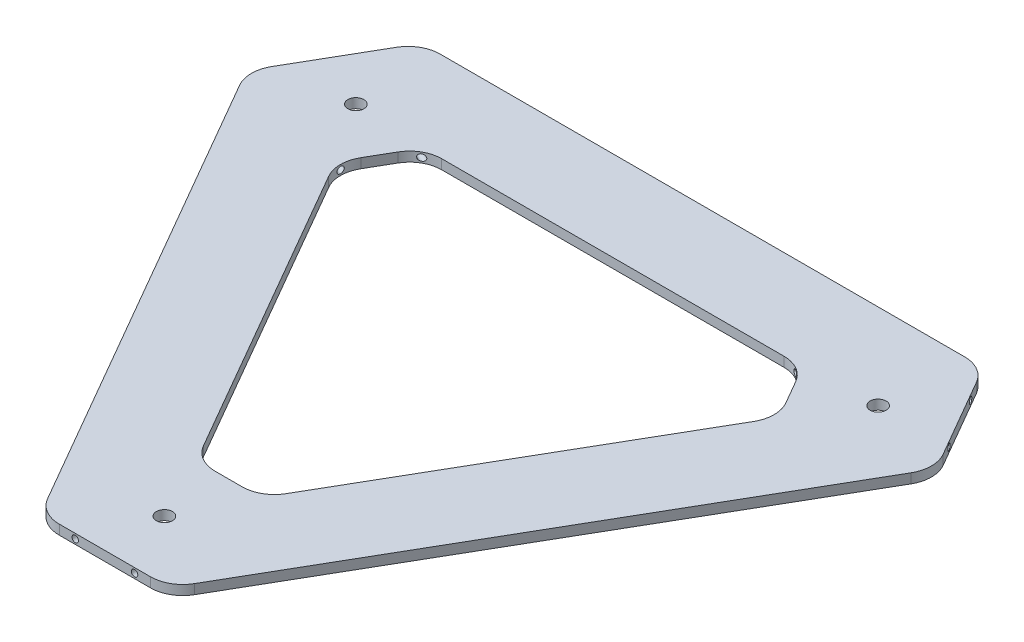
from build123d import *

# Parameters (mm, degrees)
SKETCH1_R           = 3.175
BOSS_EXTRUDE1_DEPTH = 3.81
CUT_EXTRUDE1_REACH  = 334.908
SKETCH3_R           = 1.27
CUT_EXTRUDE2_REACH  = 274.112
SKETCH5_R           = 1.27
CUT_EXTRUDE3_REACH  = 334.911
SKETCH6_R           = 1.27


with BuildPart() as part:
    # Sketch1 → Boss-Extrude1 (new body)
    with BuildSketch(Plane(origin=(0, 0, 0), x_dir=(1, 0, 0), z_dir=(0, 1, 0))):
        with BuildLine():
            Line((-132.862230357, 80.626602679), (-114.818360917, 111.876376892))
            ThreePointArc((-114.818360917, 111.876376892), (-110.170255519, 116.524341207), (-103.82099168, 118.225900714))
            Line((-103.82099168, 118.225900714), (103.762977343, 118.240259528))
            ThreePointArc((103.762977343, 118.240259528), (110.109496385, 116.541297953), (114.757781541, 111.898214981))
            Line((114.757781541, 111.898214981), (132.857908371, 80.600189632))
            ThreePointArc((132.857908371, 80.600189632), (134.563982049, 74.246129937), (132.86180691, 67.891024761))
            Line((132.86180691, 67.891024761), (29.0379736, -111.891469007))
            ThreePointArc((29.0379736, -111.891469007), (24.389544583, -116.539131318), (18.040149336, -118.240259558))
            Line((18.040149336, -118.240259558), (-18.094408415, -118.240259558))
            ThreePointArc((-18.094408415, -118.240259558), (-24.445497205, -116.538153501), (-29.09418809, -111.888081791))
            Line((-29.09418809, -111.888081791), (-132.863762321, 67.928304298))
            ThreePointArc((-132.863762321, 67.928304298), (-134.563982554, 74.277658701), (-132.862230357, 80.626602679))
        make_face()
        with Locations(Location((-103.330851621, 84.381028983, 0), (0, 0, 90))):
            Circle(SKETCH1_R, mode=Mode.SUBTRACT)
        with Locations(Location((-0.028433279, -94.702561062, 0), (0, 0, 90))):
            Circle(SKETCH1_R, mode=Mode.SUBTRACT)
        with Locations(Location((103.336854698, 84.397127461, 0), (0, 0, 90))):
            Circle(SKETCH1_R, mode=Mode.SUBTRACT)
        with BuildLine():
            Line((-84.013266269, 67.022348434), (-78.642736989, 76.323448067))
            ThreePointArc((-78.642736989, 76.323448067), (-73.995553024, 80.970880326), (-67.647495776, 82.672971564))
            Line((-67.647495776, 82.672971564), (67.773359352, 82.705030032))
            ThreePointArc((67.773359352, 82.705030032), (74.121084724, 81.006600385), (78.770291575, 76.36298581))
            Line((78.770291575, 76.36298581), (84.141622987, 67.075091406))
            ThreePointArc((84.141622987, 67.075091406), (85.847697169, 60.718674744), (84.143163353, 54.361844845))
            Line((84.143163353, 54.361844845), (16.352129804, -62.925309178))
            ThreePointArc((16.352129804, -62.925309178), (11.704017593, -67.570067982), (5.356663713, -69.27001804))
            Line((5.356663713, -69.27001804), (-5.379766134, -69.27001804))
            ThreePointArc((-5.379766134, -69.27001804), (-11.731679612, -67.567435699), (-16.380497701, -62.916190507))
            Line((-16.380497701, -62.916190507), (-84.015750126, 54.325699819))
            ThreePointArc((-84.015750126, 54.325699819), (-85.715018316, 60.674356799), (-84.013266269, 67.022348434))
        make_face(mode=Mode.SUBTRACT)
    extrude(amount=BOSS_EXTRUDE1_DEPTH)

    # Sketch3 → Cut-Extrude1 (cut, up to next)
    with BuildSketch(Plane(origin=(134.490180652, 0, -77.777728789), x_dir=(-0.5006264112230908, 0, -0.8656634429071663), z_dir=(0.8656634429071663, 0, -0.5006264112230908)), mode=Mode.PRIVATE) as cut_extrude1_sk1:
        with Locations((9.583713099, 1.905)):
            Circle(SKETCH3_R)
    cut_extrude1_tool1 = extrude(cut_extrude1_sk1.sketch, amount=-CUT_EXTRUDE1_REACH, mode=Mode.PRIVATE) & part.part
    # Sketch3 → Cut-Extrude1 (cut, up to next)
    with BuildSketch(Plane(origin=(134.490180652, 0, -77.777728789), x_dir=(-0.5006264112230908, 0, -0.8656634429071663), z_dir=(0.8656634429071663, 0, -0.5006264112230908)), mode=Mode.PRIVATE) as cut_extrude1_sk2:
        with Locations((33.073860572, 1.905)):
            Circle(SKETCH3_R)
    cut_extrude1_tool2 = extrude(cut_extrude1_sk2.sketch, amount=-CUT_EXTRUDE1_REACH, mode=Mode.PRIVATE) & part.part
    add(cut_extrude1_tool1.solids().sort_by_distance((129.692321, 1.905, -86.073999))[0], mode=Mode.SUBTRACT)
    add(cut_extrude1_tool2.solids().sort_by_distance((117.932533, 1.905, -106.408561))[0], mode=Mode.SUBTRACT)

    # Sketch5 → Cut-Extrude2 (cut, up to next)
    with BuildSketch(Plane.XY.offset(118.240259558), mode=Mode.PRIVATE) as cut_extrude2_sk1:
        with Locations((-11.784935705, 1.905)):
            Circle(SKETCH5_R)
    cut_extrude2_tool1 = extrude(cut_extrude2_sk1.sketch, amount=-CUT_EXTRUDE2_REACH, mode=Mode.PRIVATE) & part.part
    # Sketch5 → Cut-Extrude2 (cut, up to next)
    with BuildSketch(Plane.XY.offset(118.240259558), mode=Mode.PRIVATE) as cut_extrude2_sk2:
        with Locations((11.705218914, 1.905)):
            Circle(SKETCH5_R)
    cut_extrude2_tool2 = extrude(cut_extrude2_sk2.sketch, amount=-CUT_EXTRUDE2_REACH, mode=Mode.PRIVATE) & part.part
    add(cut_extrude2_tool1.solids().sort_by_distance((-11.784936, 1.905, 118.24026))[0], mode=Mode.SUBTRACT)
    add(cut_extrude2_tool2.solids().sort_by_distance((11.705219, 1.905, 118.24026))[0], mode=Mode.SUBTRACT)

    # Sketch6 → Cut-Extrude3 (cut, up to next)
    with BuildSketch(Plane(origin=(-134.555779523, 0, -77.693582727), x_dir=(-0.500037491916206, 0, 0.8660037567344326), z_dir=(-0.8660037567344328, 0, -0.500037491916206)), mode=Mode.PRIVATE) as cut_extrude3_sk1:
        with Locations((-33.174438242, 1.905)):
            Circle(SKETCH6_R)
    cut_extrude3_tool1 = extrude(cut_extrude3_sk1.sketch, amount=-CUT_EXTRUDE3_REACH, mode=Mode.PRIVATE) & part.part
    # Sketch6 → Cut-Extrude3 (cut, up to next)
    with BuildSketch(Plane(origin=(-134.555779523, 0, -77.693582727), x_dir=(-0.500037491916206, 0, 0.8660037567344326), z_dir=(-0.8660037567344328, 0, -0.500037491916206)), mode=Mode.PRIVATE) as cut_extrude3_sk2:
        with Locations((-9.684283586, 1.905)):
            Circle(SKETCH6_R)
    cut_extrude3_tool2 = extrude(cut_extrude3_sk2.sketch, amount=-CUT_EXTRUDE3_REACH, mode=Mode.PRIVATE) & part.part
    add(cut_extrude3_tool1.solids().sort_by_distance((-117.967317, 1.905, -106.422771))[0], mode=Mode.SUBTRACT)
    add(cut_extrude3_tool2.solids().sort_by_distance((-129.713275, 1.905, -86.080209))[0], mode=Mode.SUBTRACT)


solid = part.part
